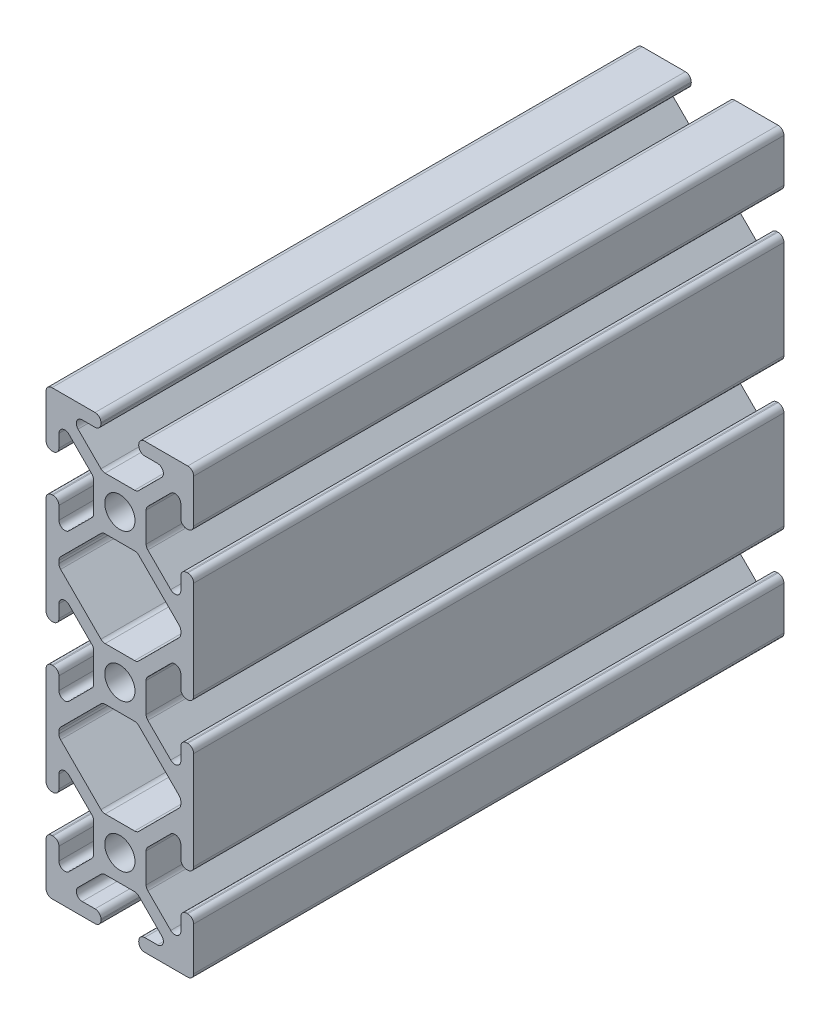
from build123d import *

# Parameters (mm, degrees)
SKETCH1_R            = 2.6035
MAIN_EXTRUSION_DEPTH = 50.8


with BuildPart() as part:
    # Sketch1 → Main Extrusion (new, symmetric)
    with BuildSketch(Plane.XY):
        with BuildLine():
            Line((-12.7, 37.084), (-12.7, 29.6672))
            ThreePointArc((-12.7, 29.6672), (-12.40242049, 28.94877951), (-11.684, 28.6512))
            Line((-11.684, 28.6512), (-11.5062, 28.6512))
            ThreePointArc((-11.5062, 28.6512), (-10.78777951, 28.94877951), (-10.4902, 29.6672))
            Line((-10.4902, 29.6672), (-10.4902, 31.874794456))
            ThreePointArc((-10.4902, 31.874794456), (-9.863006367, 32.813456061), (-8.75577951, 32.593214945))
            Line((-8.75577951, 32.593214945), (-4.81877951, 28.656214945))
            ThreePointArc((-4.81877951, 28.656214945), (-4.598538395, 28.326600823), (-4.5212, 27.937794456))
            Line((-4.5212, 27.937794456), (-4.5212, 22.862205544))
            ThreePointArc((-4.5212, 22.862205544), (-4.598538395, 22.473399177), (-4.81877951, 22.143785055))
            Line((-4.81877951, 22.143785055), (-8.75577951, 18.206785055))
            ThreePointArc((-8.75577951, 18.206785055), (-9.863006367, 17.986543939), (-10.4902, 18.925205544))
            Line((-10.4902, 18.925205544), (-10.4902, 21.1328))
            ThreePointArc((-10.4902, 21.1328), (-10.78777951, 21.85122049), (-11.5062, 22.1488))
            Line((-11.5062, 22.1488), (-11.684, 22.1488))
            ThreePointArc((-11.684, 22.1488), (-12.40242049, 21.85122049), (-12.7, 21.1328))
            Line((-12.7, 21.1328), (-12.7, 4.2672))
            ThreePointArc((-12.7, 4.2672), (-12.40242049, 3.54877951), (-11.684, 3.2512))
            Line((-11.684, 3.2512), (-11.5062, 3.2512))
            ThreePointArc((-11.5062, 3.2512), (-10.78777951, 3.54877951), (-10.4902, 4.2672))
            Line((-10.4902, 4.2672), (-10.4902, 6.474794456))
            ThreePointArc((-10.4902, 6.474794456), (-9.863006367, 7.413456061), (-8.75577951, 7.193214945))
            Line((-8.75577951, 7.193214945), (-4.81877951, 3.256214945))
            ThreePointArc((-4.81877951, 3.256214945), (-4.598538395, 2.926600823), (-4.5212, 2.537794456))
            Line((-4.5212, 2.537794456), (-4.5212, -2.537794456))
            ThreePointArc((-4.5212, -2.537794456), (-4.598538395, -2.926600823), (-4.81877951, -3.256214945))
            Line((-4.81877951, -3.256214945), (-8.75577951, -7.193214945))
            ThreePointArc((-8.75577951, -7.193214945), (-9.863006367, -7.413456061), (-10.4902, -6.474794456))
            Line((-10.4902, -6.474794456), (-10.4902, -4.2672))
            ThreePointArc((-10.4902, -4.2672), (-10.78777951, -3.54877951), (-11.5062, -3.2512))
            Line((-11.5062, -3.2512), (-11.684, -3.2512))
            ThreePointArc((-11.684, -3.2512), (-12.40242049, -3.54877951), (-12.7, -4.2672))
            Line((-12.7, -4.2672), (-12.7, -21.1328))
            ThreePointArc((-12.7, -21.1328), (-12.40242049, -21.85122049), (-11.684, -22.1488))
            Line((-11.684, -22.1488), (-11.5062, -22.1488))
            ThreePointArc((-11.5062, -22.1488), (-10.78777951, -21.85122049), (-10.4902, -21.1328))
            Line((-10.4902, -21.1328), (-10.4902, -18.925205544))
            ThreePointArc((-10.4902, -18.925205544), (-9.863006367, -17.986543939), (-8.75577951, -18.206785055))
            Line((-8.75577951, -18.206785055), (-4.81877951, -22.143785055))
            ThreePointArc((-4.81877951, -22.143785055), (-4.598538395, -22.473399177), (-4.5212, -22.862205544))
            Line((-4.5212, -22.862205544), (-4.5212, -27.937794456))
            ThreePointArc((-4.5212, -27.937794456), (-4.598538395, -28.326600823), (-4.81877951, -28.656214945))
            Line((-4.81877951, -28.656214945), (-8.75577951, -32.593214945))
            ThreePointArc((-8.75577951, -32.593214945), (-9.863006367, -32.813456061), (-10.4902, -31.874794456))
            Line((-10.4902, -31.874794456), (-10.4902, -29.6672))
            ThreePointArc((-10.4902, -29.6672), (-10.78777951, -28.94877951), (-11.5062, -28.6512))
            Line((-11.5062, -28.6512), (-11.684, -28.6512))
            ThreePointArc((-11.684, -28.6512), (-12.40242049, -28.94877951), (-12.7, -29.6672))
            Line((-12.7, -29.6672), (-12.7, -37.084))
            ThreePointArc((-12.7, -37.084), (-12.40242049, -37.80242049), (-11.684, -38.1))
            Line((-11.684, -38.1), (-4.2672, -38.1))
            ThreePointArc((-4.2672, -38.1), (-3.54877951, -37.80242049), (-3.2512, -37.084))
            Line((-3.2512, -37.084), (-3.2512, -36.9062))
            ThreePointArc((-3.2512, -36.9062), (-3.54877951, -36.18777951), (-4.2672, -35.8902))
            Line((-4.2672, -35.8902), (-6.474794456, -35.8902))
            ThreePointArc((-6.474794456, -35.8902), (-7.413456061, -35.263006367), (-7.193214945, -34.15577951))
            Line((-7.193214945, -34.15577951), (-3.256214945, -30.21877951))
            ThreePointArc((-3.256214945, -30.21877951), (-2.926600823, -29.998538395), (-2.537794456, -29.9212))
            Line((-2.537794456, -29.9212), (2.537794456, -29.9212))
            ThreePointArc((2.537794456, -29.9212), (2.926600823, -29.998538395), (3.256214945, -30.21877951))
            Line((3.256214945, -30.21877951), (7.193214945, -34.15577951))
            ThreePointArc((7.193214945, -34.15577951), (7.413456061, -35.263006367), (6.474794456, -35.8902))
            Line((6.474794456, -35.8902), (4.2672, -35.8902))
            ThreePointArc((4.2672, -35.8902), (3.54877951, -36.18777951), (3.2512, -36.9062))
            Line((3.2512, -36.9062), (3.2512, -37.084))
            ThreePointArc((3.2512, -37.084), (3.54877951, -37.80242049), (4.2672, -38.1))
            Line((4.2672, -38.1), (11.684, -38.1))
            ThreePointArc((11.684, -38.1), (12.40242049, -37.80242049), (12.7, -37.084))
            Line((12.7, -37.084), (12.7, -29.6672))
            ThreePointArc((12.7, -29.6672), (12.40242049, -28.94877951), (11.684, -28.6512))
            Line((11.684, -28.6512), (11.5062, -28.6512))
            ThreePointArc((11.5062, -28.6512), (10.78777951, -28.94877951), (10.4902, -29.6672))
            Line((10.4902, -29.6672), (10.4902, -31.874794456))
            ThreePointArc((10.4902, -31.874794456), (9.863006367, -32.813456061), (8.75577951, -32.593214945))
            Line((8.75577951, -32.593214945), (4.81877951, -28.656214945))
            ThreePointArc((4.81877951, -28.656214945), (4.598538395, -28.326600823), (4.5212, -27.937794456))
            Line((4.5212, -27.937794456), (4.5212, -22.862205544))
            ThreePointArc((4.5212, -22.862205544), (4.598538395, -22.473399177), (4.81877951, -22.143785055))
            Line((4.81877951, -22.143785055), (8.75577951, -18.206785055))
            ThreePointArc((8.75577951, -18.206785055), (9.863006367, -17.986543939), (10.4902, -18.925205544))
            Line((10.4902, -18.925205544), (10.4902, -21.1328))
            ThreePointArc((10.4902, -21.1328), (10.78777951, -21.85122049), (11.5062, -22.1488))
            Line((11.5062, -22.1488), (11.684, -22.1488))
            ThreePointArc((11.684, -22.1488), (12.40242049, -21.85122049), (12.7, -21.1328))
            Line((12.7, -21.1328), (12.7, -4.2672))
            ThreePointArc((12.7, -4.2672), (12.40242049, -3.54877951), (11.684, -3.2512))
            Line((11.684, -3.2512), (11.5062, -3.2512))
            ThreePointArc((11.5062, -3.2512), (10.78777951, -3.54877951), (10.4902, -4.2672))
            Line((10.4902, -4.2672), (10.4902, -6.474794456))
            ThreePointArc((10.4902, -6.474794456), (9.863006367, -7.413456061), (8.75577951, -7.193214945))
            Line((8.75577951, -7.193214945), (4.81877951, -3.256214945))
            ThreePointArc((4.81877951, -3.256214945), (4.598538395, -2.926600823), (4.5212, -2.537794456))
            Line((4.5212, -2.537794456), (4.5212, 2.537794456))
            ThreePointArc((4.5212, 2.537794456), (4.598538395, 2.926600823), (4.81877951, 3.256214945))
            Line((4.81877951, 3.256214945), (8.75577951, 7.193214945))
            ThreePointArc((8.75577951, 7.193214945), (9.863006367, 7.413456061), (10.4902, 6.474794456))
            Line((10.4902, 6.474794456), (10.4902, 4.2672))
            ThreePointArc((10.4902, 4.2672), (10.78777951, 3.54877951), (11.5062, 3.2512))
            Line((11.5062, 3.2512), (11.684, 3.2512))
            ThreePointArc((11.684, 3.2512), (12.40242049, 3.54877951), (12.7, 4.2672))
            Line((12.7, 4.2672), (12.7, 21.1328))
            ThreePointArc((12.7, 21.1328), (12.40242049, 21.85122049), (11.684, 22.1488))
            Line((11.684, 22.1488), (11.5062, 22.1488))
            ThreePointArc((11.5062, 22.1488), (10.78777951, 21.85122049), (10.4902, 21.1328))
            Line((10.4902, 21.1328), (10.4902, 18.925205544))
            ThreePointArc((10.4902, 18.925205544), (9.863006367, 17.986543939), (8.75577951, 18.206785055))
            Line((8.75577951, 18.206785055), (4.81877951, 22.143785055))
            ThreePointArc((4.81877951, 22.143785055), (4.598538395, 22.473399177), (4.5212, 22.862205544))
            Line((4.5212, 22.862205544), (4.5212, 27.937794456))
            ThreePointArc((4.5212, 27.937794456), (4.598538395, 28.326600823), (4.81877951, 28.656214945))
            Line((4.81877951, 28.656214945), (8.75577951, 32.593214945))
            ThreePointArc((8.75577951, 32.593214945), (9.863006367, 32.813456061), (10.4902, 31.874794456))
            Line((10.4902, 31.874794456), (10.4902, 29.6672))
            ThreePointArc((10.4902, 29.6672), (10.78777951, 28.94877951), (11.5062, 28.6512))
            Line((11.5062, 28.6512), (11.684, 28.6512))
            ThreePointArc((11.684, 28.6512), (12.40242049, 28.94877951), (12.7, 29.6672))
            Line((12.7, 29.6672), (12.7, 37.084))
            ThreePointArc((12.7, 37.084), (12.40242049, 37.80242049), (11.684, 38.1))
            Line((11.684, 38.1), (4.2672, 38.1))
            ThreePointArc((4.2672, 38.1), (3.54877951, 37.80242049), (3.2512, 37.084))
            Line((3.2512, 37.084), (3.2512, 36.9062))
            ThreePointArc((3.2512, 36.9062), (3.54877951, 36.18777951), (4.2672, 35.8902))
            Line((4.2672, 35.8902), (6.474794456, 35.8902))
            ThreePointArc((6.474794456, 35.8902), (7.413456061, 35.263006367), (7.193214945, 34.15577951))
            Line((7.193214945, 34.15577951), (3.256214945, 30.21877951))
            ThreePointArc((3.256214945, 30.21877951), (2.926600823, 29.998538395), (2.537794456, 29.9212))
            Line((2.537794456, 29.9212), (-2.537794456, 29.9212))
            ThreePointArc((-2.537794456, 29.9212), (-2.926600823, 29.998538395), (-3.256214945, 30.21877951))
            Line((-3.256214945, 30.21877951), (-7.193214945, 34.15577951))
            ThreePointArc((-7.193214945, 34.15577951), (-7.413456061, 35.263006367), (-6.474794456, 35.8902))
            Line((-6.474794456, 35.8902), (-4.2672, 35.8902))
            ThreePointArc((-4.2672, 35.8902), (-3.54877951, 36.18777951), (-3.2512, 36.9062))
            Line((-3.2512, 36.9062), (-3.2512, 37.084))
            ThreePointArc((-3.2512, 37.084), (-3.54877951, 37.80242049), (-4.2672, 38.1))
            Line((-4.2672, 38.1), (-11.684, 38.1))
            ThreePointArc((-11.684, 38.1), (-12.40242049, 37.80242049), (-12.7, 37.084))
        make_face()
        with Locations((0, 25.4)):
            Circle(SKETCH1_R, mode=Mode.SUBTRACT)
        Circle(SKETCH1_R, mode=Mode.SUBTRACT)
        with Locations((0, -25.4)):
            Circle(SKETCH1_R, mode=Mode.SUBTRACT)
        with BuildLine():
            Line((-10.4902, 12.473605544), (-10.4902, 12.926394456))
            ThreePointArc((-10.4902, 12.926394456), (-10.412861605, 13.315200823), (-10.19262049, 13.644814945))
            Line((-10.19262049, 13.644814945), (-3.256214945, 20.58122049))
            ThreePointArc((-3.256214945, 20.58122049), (-2.926600823, 20.801461605), (-2.537794456, 20.8788))
            Line((-2.537794456, 20.8788), (2.537794456, 20.8788))
            ThreePointArc((2.537794456, 20.8788), (2.926600823, 20.801461605), (3.256214945, 20.58122049))
            Line((3.256214945, 20.58122049), (10.19262049, 13.644814945))
            ThreePointArc((10.19262049, 13.644814945), (10.412861605, 13.315200823), (10.4902, 12.926394456))
            Line((10.4902, 12.926394456), (10.4902, 12.473605544))
            ThreePointArc((10.4902, 12.473605544), (10.412861605, 12.084799177), (10.19262049, 11.755185055))
            Line((10.19262049, 11.755185055), (3.256214945, 4.81877951))
            ThreePointArc((3.256214945, 4.81877951), (2.926600823, 4.598538395), (2.537794456, 4.5212))
            Line((2.537794456, 4.5212), (-2.537794456, 4.5212))
            ThreePointArc((-2.537794456, 4.5212), (-2.926600823, 4.598538395), (-3.256214945, 4.81877951))
            Line((-3.256214945, 4.81877951), (-10.19262049, 11.755185055))
            ThreePointArc((-10.19262049, 11.755185055), (-10.412861605, 12.084799177), (-10.4902, 12.473605544))
        make_face(mode=Mode.SUBTRACT)
        with BuildLine():
            Line((-2.537794456, -4.5212), (2.537794456, -4.5212))
            ThreePointArc((2.537794456, -4.5212), (2.926600823, -4.598538395), (3.256214945, -4.81877951))
            Line((3.256214945, -4.81877951), (10.19262049, -11.755185055))
            ThreePointArc((10.19262049, -11.755185055), (10.412861605, -12.084799177), (10.4902, -12.473605544))
            Line((10.4902, -12.473605544), (10.4902, -12.926394456))
            ThreePointArc((10.4902, -12.926394456), (10.412861605, -13.315200823), (10.19262049, -13.644814945))
            Line((10.19262049, -13.644814945), (3.256214945, -20.58122049))
            ThreePointArc((3.256214945, -20.58122049), (2.926600823, -20.801461605), (2.537794456, -20.8788))
            Line((2.537794456, -20.8788), (-2.537794456, -20.8788))
            ThreePointArc((-2.537794456, -20.8788), (-2.926600823, -20.801461605), (-3.256214945, -20.58122049))
            Line((-3.256214945, -20.58122049), (-10.19262049, -13.644814945))
            ThreePointArc((-10.19262049, -13.644814945), (-10.412861605, -13.315200823), (-10.4902, -12.926394456))
            Line((-10.4902, -12.926394456), (-10.4902, -12.473605544))
            ThreePointArc((-10.4902, -12.473605544), (-10.412861605, -12.084799177), (-10.19262049, -11.755185055))
            Line((-10.19262049, -11.755185055), (-3.256214945, -4.81877951))
            ThreePointArc((-3.256214945, -4.81877951), (-2.926600823, -4.598538395), (-2.537794456, -4.5212))
        make_face(mode=Mode.SUBTRACT)
    extrude(amount=MAIN_EXTRUSION_DEPTH, both=True)


solid = part.part
